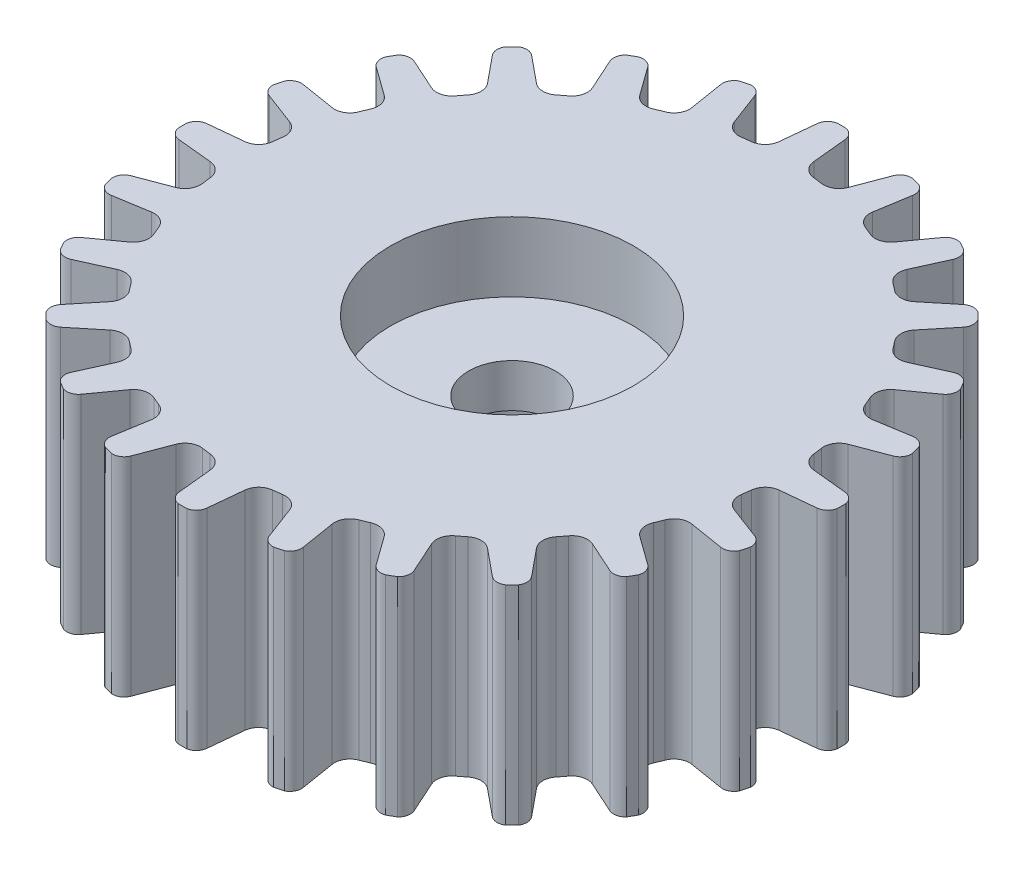
from build123d import *

# Parameters (mm, degrees)
SKETCH1_R           = 9.5
SKETCH1_R_2         = 2.25
BOSS_EXTRUDE1_DEPTH = 6
CUT_EXTRUDE1_START  = -6
SKETCH2_R           = 11.178148921
CUT_EXTRUDE1_DEPTH  = 6
BOSS_EXTRUDE2_START = -3.25
SKETCH3_R           = 2.25
SKETCH3_R_2         = 1.25
BOSS_EXTRUDE2_DEPTH = 3.25
SKETCH4_R           = 3.5
CUT_EXTRUDE2_DEPTH  = 2


with BuildPart() as part:
    # Sketch1 → Boss-Extrude1 (new body)
    with BuildSketch(Plane(origin=(0, 0, 0), x_dir=(1, 0, 0), z_dir=(0, 1, 0))):
        with Locations(Location((0, 0, 0), (0, 0, 270))):
            Circle(SKETCH1_R)
        with Locations(Location((0, 0, 0), (0, 0, 270))):
            Circle(SKETCH1_R_2, mode=Mode.SUBTRACT)
    extrude(amount=BOSS_EXTRUDE1_DEPTH)

    # Sketch2 → Cut-Extrude1 (cut)
    with BuildSketch(Plane(origin=(0, 6, 0), x_dir=(1, 0, 0), z_dir=(0, 1, 0)).offset(CUT_EXTRUDE1_START)):
        Circle(SKETCH2_R)
        with BuildLine():
            Line((0.5, 8.2), (0.4, 9.2))
            ThreePointArc((0.4, 9.2), (0.265875857, 9.437834476), (0, 9.5))
            ThreePointArc((0, 9.5), (-0.265875857, 9.437834476), (-0.4, 9.2))
            Line((-0.4, 9.2), (-0.5, 8.2))
            ThreePointArc((-0.5, 8.2), (-0.628607324, 7.928607324), (-0.9, 7.8))
            ThreePointArc((-0.9, 7.8), (-1.024859212, 7.784578575), (-1.149455308, 7.767158586))
            ThreePointArc((-1.149455308, 7.767158586), (-1.444886527, 7.821142129), (-1.639353257, 8.050001298))
            Line((-1.639353257, 8.050001298), (-1.994764884, 8.99004522))
            ThreePointArc((-1.994764884, 8.99004522), (-2.18587495, 9.1850618), (-2.458780928, 9.17629535))
            ThreePointArc((-2.458780928, 9.17629535), (-2.699507664, 9.047434329), (-2.767505545, 8.782989984))
            Line((-2.767505545, 8.782989984), (-2.605279083, 7.791182253))
            ThreePointArc((-2.605279083, 7.791182253), (-2.659262626, 7.495751034), (-2.888121795, 7.301284304))
            ThreePointArc((-2.888121795, 7.301284304), (-3.004735175, 7.25407241), (-3.120577137, 7.20499815))
            ThreePointArc((-3.120577137, 7.20499815), (-3.41991375, 7.180679022), (-3.666987298, 7.351408311))
            Line((-3.666987298, 7.351408311), (-4.253589838, 8.167433715))
            ThreePointArc((-4.253589838, 8.167433715), (-4.488661992, 8.306342342), (-4.75, 8.227241336))
            ThreePointArc((-4.75, 8.227241336), (-4.949172485, 8.040466485), (-4.946410162, 7.767433715))
            Line((-4.946410162, 7.767433715), (-4.533012702, 6.851408311))
            ThreePointArc((-4.533012702, 6.851408311), (-4.508693574, 6.552071697), (-4.679422863, 6.30499815))
            ThreePointArc((-4.679422863, 6.30499815), (-4.779843401, 6.229213198), (-4.87903679, 6.151828996))
            ThreePointArc((-4.87903679, 6.151828996), (-5.161879503, 6.050864506), (-5.444722215, 6.151828996))
            Line((-5.444722215, 6.151828996), (-6.222539674, 6.788225099))
            ThreePointArc((-6.222539674, 6.788225099), (-6.485554136, 6.861559379), (-6.717514421, 6.717514421))
            ThreePointArc((-6.717514421, 6.717514421), (-6.861559379, 6.485554136), (-6.788225099, 6.222539674))
            Line((-6.788225099, 6.222539674), (-6.151828996, 5.444722215))
            ThreePointArc((-6.151828996, 5.444722215), (-6.050864506, 5.161879503), (-6.151828996, 4.87903679))
            ThreePointArc((-6.151828996, 4.87903679), (-6.229213198, 4.779843401), (-6.30499815, 4.679422863))
            ThreePointArc((-6.30499815, 4.679422863), (-6.552071697, 4.508693574), (-6.851408311, 4.533012702))
            Line((-6.851408311, 4.533012702), (-7.767433715, 4.946410162))
            ThreePointArc((-7.767433715, 4.946410162), (-8.040466485, 4.949172485), (-8.227241336, 4.75))
            ThreePointArc((-8.227241336, 4.75), (-8.306342342, 4.488661992), (-8.167433715, 4.253589838))
            Line((-8.167433715, 4.253589838), (-7.351408311, 3.666987298))
            ThreePointArc((-7.351408311, 3.666987298), (-7.180679022, 3.41991375), (-7.20499815, 3.120577137))
            ThreePointArc((-7.20499815, 3.120577137), (-7.25407241, 3.004735175), (-7.301284304, 2.888121795))
            ThreePointArc((-7.301284304, 2.888121795), (-7.495751034, 2.659262626), (-7.791182253, 2.605279083))
            Line((-7.791182253, 2.605279083), (-8.782989984, 2.767505545))
            ThreePointArc((-8.782989984, 2.767505545), (-9.047434329, 2.699507664), (-9.17629535, 2.458780928))
            ThreePointArc((-9.17629535, 2.458780928), (-9.1850618, 2.18587495), (-8.99004522, 1.994764884))
            Line((-8.99004522, 1.994764884), (-8.050001298, 1.639353257))
            ThreePointArc((-8.050001298, 1.639353257), (-7.821142129, 1.444886527), (-7.767158586, 1.149455308))
            ThreePointArc((-7.767158586, 1.149455308), (-7.784578575, 1.024859212), (-7.8, 0.9))
            ThreePointArc((-7.8, 0.9), (-7.928607324, 0.628607324), (-8.2, 0.5))
            Line((-8.2, 0.5), (-9.2, 0.4))
            ThreePointArc((-9.2, 0.4), (-9.437834476, 0.265875857), (-9.5, 0))
            ThreePointArc((-9.5, 0), (-9.437834476, -0.265875857), (-9.2, -0.4))
            Line((-9.2, -0.4), (-8.2, -0.5))
            ThreePointArc((-8.2, -0.5), (-7.928607324, -0.628607324), (-7.8, -0.9))
            ThreePointArc((-7.8, -0.9), (-7.784578575, -1.024859212), (-7.767158586, -1.149455308))
            ThreePointArc((-7.767158586, -1.149455308), (-7.821142129, -1.444886527), (-8.050001298, -1.639353257))
            Line((-8.050001298, -1.639353257), (-8.99004522, -1.994764884))
            ThreePointArc((-8.99004522, -1.994764884), (-9.1850618, -2.18587495), (-9.17629535, -2.458780928))
            ThreePointArc((-9.17629535, -2.458780928), (-9.047434329, -2.699507664), (-8.782989984, -2.767505545))
            Line((-8.782989984, -2.767505545), (-7.791182253, -2.605279083))
            ThreePointArc((-7.791182253, -2.605279083), (-7.495751034, -2.659262626), (-7.301284304, -2.888121795))
            ThreePointArc((-7.301284304, -2.888121795), (-7.25407241, -3.004735175), (-7.20499815, -3.120577137))
            ThreePointArc((-7.20499815, -3.120577137), (-7.180679022, -3.41991375), (-7.351408311, -3.666987298))
            Line((-7.351408311, -3.666987298), (-8.167433715, -4.253589838))
            ThreePointArc((-8.167433715, -4.253589838), (-8.306342342, -4.488661992), (-8.227241336, -4.75))
            ThreePointArc((-8.227241336, -4.75), (-8.040466485, -4.949172485), (-7.767433715, -4.946410162))
            Line((-7.767433715, -4.946410162), (-6.851408311, -4.533012702))
            ThreePointArc((-6.851408311, -4.533012702), (-6.552071697, -4.508693574), (-6.30499815, -4.679422863))
            ThreePointArc((-6.30499815, -4.679422863), (-6.229213198, -4.779843401), (-6.151828996, -4.87903679))
            ThreePointArc((-6.151828996, -4.87903679), (-6.050864506, -5.161879503), (-6.151828996, -5.444722215))
            Line((-6.151828996, -5.444722215), (-6.788225099, -6.222539674))
            ThreePointArc((-6.788225099, -6.222539674), (-6.861559379, -6.485554136), (-6.717514421, -6.717514421))
            ThreePointArc((-6.717514421, -6.717514421), (-6.485554136, -6.861559379), (-6.222539674, -6.788225099))
            Line((-6.222539674, -6.788225099), (-5.444722215, -6.151828996))
            ThreePointArc((-5.444722215, -6.151828996), (-5.161879503, -6.050864506), (-4.87903679, -6.151828996))
            ThreePointArc((-4.87903679, -6.151828996), (-4.779843401, -6.229213198), (-4.679422863, -6.30499815))
            ThreePointArc((-4.679422863, -6.30499815), (-4.508693574, -6.552071697), (-4.533012702, -6.851408311))
            Line((-4.533012702, -6.851408311), (-4.946410162, -7.767433715))
            ThreePointArc((-4.946410162, -7.767433715), (-4.949172485, -8.040466485), (-4.75, -8.227241336))
            ThreePointArc((-4.75, -8.227241336), (-4.488661992, -8.306342342), (-4.253589838, -8.167433715))
            Line((-4.253589838, -8.167433715), (-3.666987298, -7.351408311))
            ThreePointArc((-3.666987298, -7.351408311), (-3.41991375, -7.180679022), (-3.120577137, -7.20499815))
            ThreePointArc((-3.120577137, -7.20499815), (-3.004735175, -7.25407241), (-2.888121795, -7.301284304))
            ThreePointArc((-2.888121795, -7.301284304), (-2.659262626, -7.495751034), (-2.605279083, -7.791182253))
            Line((-2.605279083, -7.791182253), (-2.767505545, -8.782989984))
            ThreePointArc((-2.767505545, -8.782989984), (-2.699507664, -9.047434329), (-2.458780928, -9.17629535))
            ThreePointArc((-2.458780928, -9.17629535), (-2.18587495, -9.1850618), (-1.994764884, -8.99004522))
            Line((-1.994764884, -8.99004522), (-1.639353257, -8.050001298))
            ThreePointArc((-1.639353257, -8.050001298), (-1.444886527, -7.821142129), (-1.149455308, -7.767158586))
            ThreePointArc((-1.149455308, -7.767158586), (-1.024859212, -7.784578575), (-0.9, -7.8))
            ThreePointArc((-0.9, -7.8), (-0.628607324, -7.928607324), (-0.5, -8.2))
            Line((-0.5, -8.2), (-0.4, -9.2))
            ThreePointArc((-0.4, -9.2), (-0.265875857, -9.437834476), (0, -9.5))
            ThreePointArc((0, -9.5), (0.265875857, -9.437834476), (0.4, -9.2))
            Line((0.4, -9.2), (0.5, -8.2))
            ThreePointArc((0.5, -8.2), (0.628607324, -7.928607324), (0.9, -7.8))
            ThreePointArc((0.9, -7.8), (1.024859212, -7.784578575), (1.149455308, -7.767158586))
            ThreePointArc((1.149455308, -7.767158586), (1.444886527, -7.821142129), (1.639353257, -8.050001298))
            Line((1.639353257, -8.050001298), (1.994764884, -8.99004522))
            ThreePointArc((1.994764884, -8.99004522), (2.18587495, -9.1850618), (2.458780928, -9.17629535))
            ThreePointArc((2.458780928, -9.17629535), (2.699507664, -9.047434329), (2.767505545, -8.782989984))
            Line((2.767505545, -8.782989984), (2.605279083, -7.791182253))
            ThreePointArc((2.605279083, -7.791182253), (2.659262626, -7.495751034), (2.888121795, -7.301284304))
            ThreePointArc((2.888121795, -7.301284304), (3.004735175, -7.25407241), (3.120577137, -7.20499815))
            ThreePointArc((3.120577137, -7.20499815), (3.41991375, -7.180679022), (3.666987298, -7.351408311))
            Line((3.666987298, -7.351408311), (4.253589838, -8.167433715))
            ThreePointArc((4.253589838, -8.167433715), (4.488661992, -8.306342342), (4.75, -8.227241336))
            ThreePointArc((4.75, -8.227241336), (4.949172485, -8.040466485), (4.946410162, -7.767433715))
            Line((4.946410162, -7.767433715), (4.533012702, -6.851408311))
            ThreePointArc((4.533012702, -6.851408311), (4.508693574, -6.552071697), (4.679422863, -6.30499815))
            ThreePointArc((4.679422863, -6.30499815), (4.779843401, -6.229213198), (4.87903679, -6.151828996))
            ThreePointArc((4.87903679, -6.151828996), (5.161879503, -6.050864506), (5.444722215, -6.151828996))
            Line((5.444722215, -6.151828996), (6.222539674, -6.788225099))
            ThreePointArc((6.222539674, -6.788225099), (6.485554136, -6.861559379), (6.717514421, -6.717514421))
            ThreePointArc((6.717514421, -6.717514421), (6.861559379, -6.485554136), (6.788225099, -6.222539674))
            Line((6.788225099, -6.222539674), (6.151828996, -5.444722215))
            ThreePointArc((6.151828996, -5.444722215), (6.050864506, -5.161879503), (6.151828996, -4.87903679))
            ThreePointArc((6.151828996, -4.87903679), (6.229213198, -4.779843401), (6.30499815, -4.679422863))
            ThreePointArc((6.30499815, -4.679422863), (6.552071697, -4.508693574), (6.851408311, -4.533012702))
            Line((6.851408311, -4.533012702), (7.767433715, -4.946410162))
            ThreePointArc((7.767433715, -4.946410162), (8.040466485, -4.949172485), (8.227241336, -4.75))
            ThreePointArc((8.227241336, -4.75), (8.306342342, -4.488661992), (8.167433715, -4.253589838))
            Line((8.167433715, -4.253589838), (7.351408311, -3.666987298))
            ThreePointArc((7.351408311, -3.666987298), (7.180679022, -3.41991375), (7.20499815, -3.120577137))
            ThreePointArc((7.20499815, -3.120577137), (7.25407241, -3.004735175), (7.301284304, -2.888121795))
            ThreePointArc((7.301284304, -2.888121795), (7.495751034, -2.659262626), (7.791182253, -2.605279083))
            Line((7.791182253, -2.605279083), (8.782989984, -2.767505545))
            ThreePointArc((8.782989984, -2.767505545), (9.047434329, -2.699507664), (9.17629535, -2.458780928))
            ThreePointArc((9.17629535, -2.458780928), (9.1850618, -2.18587495), (8.99004522, -1.994764884))
            Line((8.99004522, -1.994764884), (8.050001298, -1.639353257))
            ThreePointArc((8.050001298, -1.639353257), (7.821142129, -1.444886527), (7.767158586, -1.149455308))
            ThreePointArc((7.767158586, -1.149455308), (7.784578575, -1.024859212), (7.8, -0.9))
            ThreePointArc((7.8, -0.9), (7.928607324, -0.628607324), (8.2, -0.5))
            Line((8.2, -0.5), (9.2, -0.4))
            ThreePointArc((9.2, -0.4), (9.437834476, -0.265875857), (9.5, 0))
            ThreePointArc((9.5, 0), (9.437834476, 0.265875857), (9.2, 0.4))
            Line((9.2, 0.4), (8.2, 0.5))
            ThreePointArc((8.2, 0.5), (7.928607324, 0.628607324), (7.8, 0.9))
            ThreePointArc((7.8, 0.9), (7.784578575, 1.024859212), (7.767158586, 1.149455308))
            ThreePointArc((7.767158586, 1.149455308), (7.821142129, 1.444886527), (8.050001298, 1.639353257))
            Line((8.050001298, 1.639353257), (8.99004522, 1.994764884))
            ThreePointArc((8.99004522, 1.994764884), (9.1850618, 2.18587495), (9.17629535, 2.458780928))
            ThreePointArc((9.17629535, 2.458780928), (9.047434329, 2.699507664), (8.782989984, 2.767505545))
            Line((8.782989984, 2.767505545), (7.791182253, 2.605279083))
            ThreePointArc((7.791182253, 2.605279083), (7.495751034, 2.659262626), (7.301284304, 2.888121795))
            ThreePointArc((7.301284304, 2.888121795), (7.25407241, 3.004735175), (7.20499815, 3.120577137))
            ThreePointArc((7.20499815, 3.120577137), (7.180679022, 3.41991375), (7.351408311, 3.666987298))
            Line((7.351408311, 3.666987298), (8.167433715, 4.253589838))
            ThreePointArc((8.167433715, 4.253589838), (8.306342342, 4.488661992), (8.227241336, 4.75))
            ThreePointArc((8.227241336, 4.75), (8.040466485, 4.949172485), (7.767433715, 4.946410162))
            Line((7.767433715, 4.946410162), (6.851408311, 4.533012702))
            ThreePointArc((6.851408311, 4.533012702), (6.552071697, 4.508693574), (6.30499815, 4.679422863))
            ThreePointArc((6.30499815, 4.679422863), (6.229213198, 4.779843401), (6.151828996, 4.87903679))
            ThreePointArc((6.151828996, 4.87903679), (6.050864506, 5.161879503), (6.151828996, 5.444722215))
            Line((6.151828996, 5.444722215), (6.788225099, 6.222539674))
            ThreePointArc((6.788225099, 6.222539674), (6.861559379, 6.485554136), (6.717514421, 6.717514421))
            ThreePointArc((6.717514421, 6.717514421), (6.485554136, 6.861559379), (6.222539674, 6.788225099))
            Line((6.222539674, 6.788225099), (5.444722215, 6.151828996))
            ThreePointArc((5.444722215, 6.151828996), (5.161879503, 6.050864506), (4.87903679, 6.151828996))
            ThreePointArc((4.87903679, 6.151828996), (4.779843401, 6.229213198), (4.679422863, 6.30499815))
            ThreePointArc((4.679422863, 6.30499815), (4.508693574, 6.552071697), (4.533012702, 6.851408311))
            Line((4.533012702, 6.851408311), (4.946410162, 7.767433715))
            ThreePointArc((4.946410162, 7.767433715), (4.949172485, 8.040466485), (4.75, 8.227241336))
            ThreePointArc((4.75, 8.227241336), (4.488661992, 8.306342342), (4.253589838, 8.167433715))
            Line((4.253589838, 8.167433715), (3.666987298, 7.351408311))
            ThreePointArc((3.666987298, 7.351408311), (3.41991375, 7.180679022), (3.120577137, 7.20499815))
            ThreePointArc((3.120577137, 7.20499815), (3.004735175, 7.25407241), (2.888121795, 7.301284304))
            ThreePointArc((2.888121795, 7.301284304), (2.659262626, 7.495751034), (2.605279083, 7.791182253))
            Line((2.605279083, 7.791182253), (2.767505545, 8.782989984))
            ThreePointArc((2.767505545, 8.782989984), (2.699507664, 9.047434329), (2.458780928, 9.17629535))
            ThreePointArc((2.458780928, 9.17629535), (2.18587495, 9.1850618), (1.994764884, 8.99004522))
            Line((1.994764884, 8.99004522), (1.639353257, 8.050001298))
            ThreePointArc((1.639353257, 8.050001298), (1.444886527, 7.821142129), (1.149455308, 7.767158586))
            ThreePointArc((1.149455308, 7.767158586), (1.024859212, 7.784578575), (0.9, 7.8))
            ThreePointArc((0.9, 7.8), (0.628607324, 7.928607324), (0.5, 8.2))
        make_face(mode=Mode.SUBTRACT)
    extrude(amount=CUT_EXTRUDE1_DEPTH, mode=Mode.SUBTRACT)

    # Sketch3 → Boss-Extrude2 (add)
    with BuildSketch(Plane(origin=(0, 6, 0), x_dir=(1, 0, 0), z_dir=(0, 1, 0)).offset(BOSS_EXTRUDE2_START)):
        with Locations(Location((0, 0, 0), (0, 0, 270))):
            Circle(SKETCH3_R)
        with Locations(Location((0, 0, 0), (0, 0, 270))):
            Circle(SKETCH3_R_2, mode=Mode.SUBTRACT)
    extrude(amount=BOSS_EXTRUDE2_DEPTH)

    # Sketch4 → Cut-Extrude2 (cut)
    with BuildSketch(Plane(origin=(0, 6, 0), x_dir=(1, 0, 0), z_dir=(0, 1, 0))):
        with Locations(Location((0, 0, 0), (0, 0, 270))):
            Circle(SKETCH4_R)
    extrude(amount=-CUT_EXTRUDE2_DEPTH, mode=Mode.SUBTRACT)


solid = part.part
